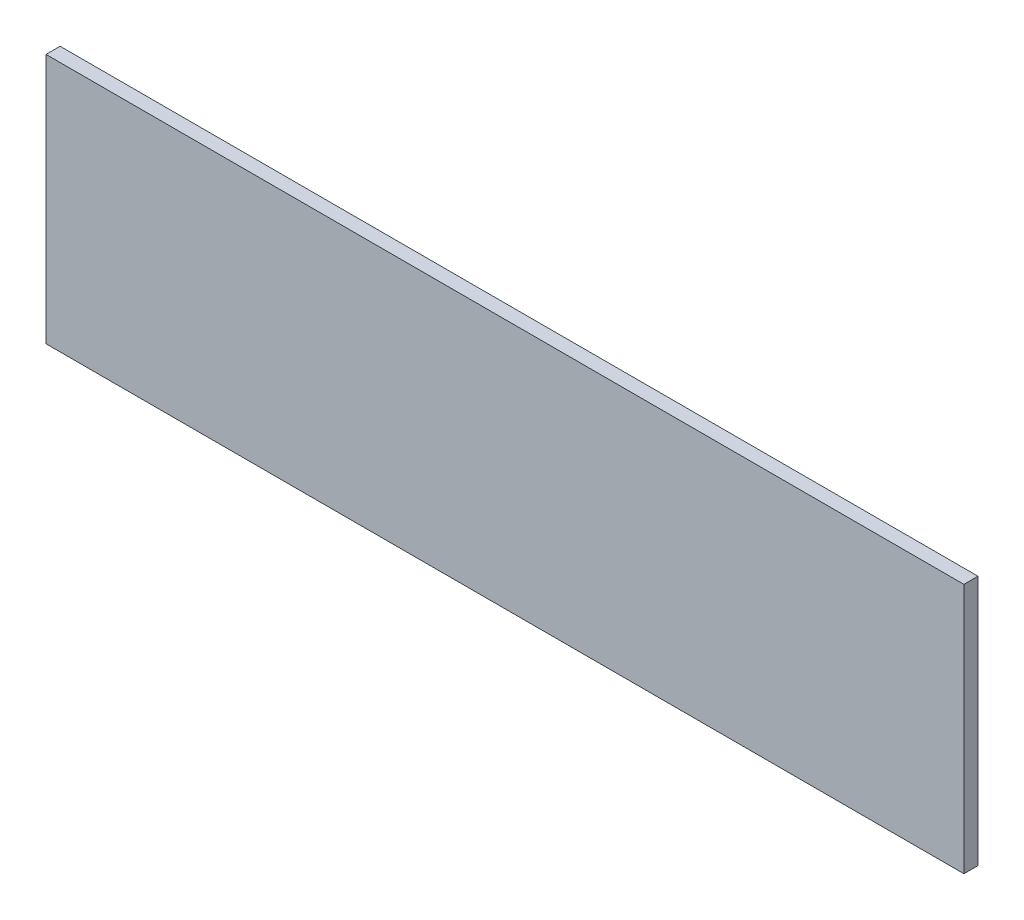
from build123d import *

# Parameters (mm, degrees)
SKETCH1_W           = 293
SKETCH1_H           = 80
BOSS_EXTRUDE1_DEPTH = 4.5


with BuildPart() as part:
    # Sketch1 → Boss-Extrude1 (new body)
    with BuildSketch(Plane.XY):
        Rectangle(SKETCH1_W, SKETCH1_H)
    extrude(amount=BOSS_EXTRUDE1_DEPTH)


solid = part.part
